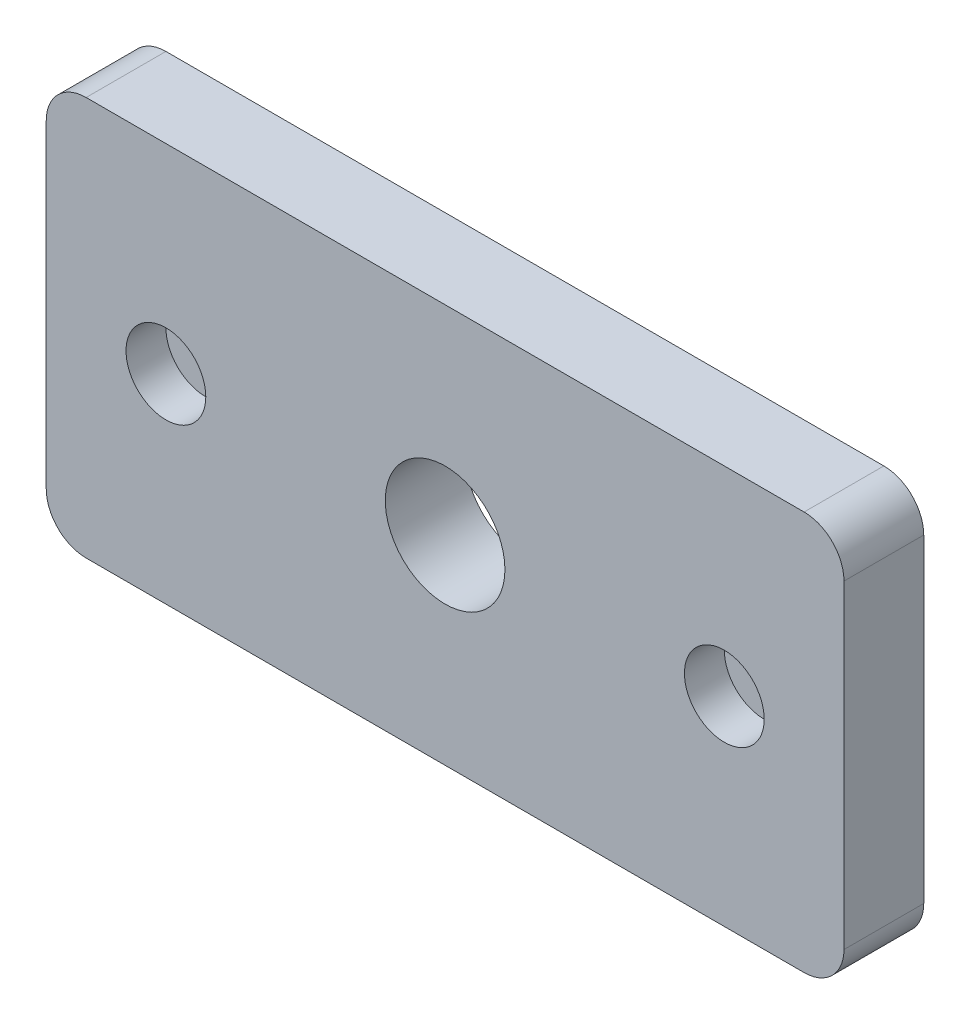
from build123d import *

# Parameters (mm, degrees)
SKETCH1_W           = 10000
SKETCH1_H           = 5000
BOSS_EXTRUDE1_DEPTH = 1000
FILLET1_R           = 500
FILLET2_R           = 500
SKETCH2_R           = 500
CUT_EXTRUDE1_DEPTH  = 500
SKETCH3_R           = 750
CUT_EXTRUDE2_DEPTH  = 5679.9083458


with BuildPart() as part:
    # Sketch1 → Boss-Extrude1 (new body)
    with BuildSketch(Plane.XY):
        Rectangle(SKETCH1_W, SKETCH1_H)
    extrude(amount=BOSS_EXTRUDE1_DEPTH)

    # Fillet1
    fillet1_edges = [part.edges().sort_by_distance(p)[0] for p in [
        (-5000, 2500, 500),
    ]]
    fillet(fillet1_edges, radius=FILLET1_R)

    # Fillet2
    fillet2_edges = [part.edges().sort_by_distance(p)[0] for p in [
        (5000, -2500, 500),
        (-5000, -2500, 500),
        (5000, 2500, 500),
    ]]
    fillet(fillet2_edges, radius=FILLET2_R)

    # Sketch2 → Cut-Extrude1 (cut)
    with BuildSketch(Plane.XY.offset(1000)):
        with Locations((-3500, 0)):
            Circle(SKETCH2_R)
        with Locations((3500, 0)):
            Circle(SKETCH2_R)
    extrude(amount=-CUT_EXTRUDE1_DEPTH, mode=Mode.SUBTRACT)

    # Sketch3 → Cut-Extrude2 (cut, through all)
    with BuildSketch(Plane.XY.offset(1000)):
        Circle(SKETCH3_R)
    extrude(amount=-CUT_EXTRUDE2_DEPTH, mode=Mode.SUBTRACT)


solid = part.part
